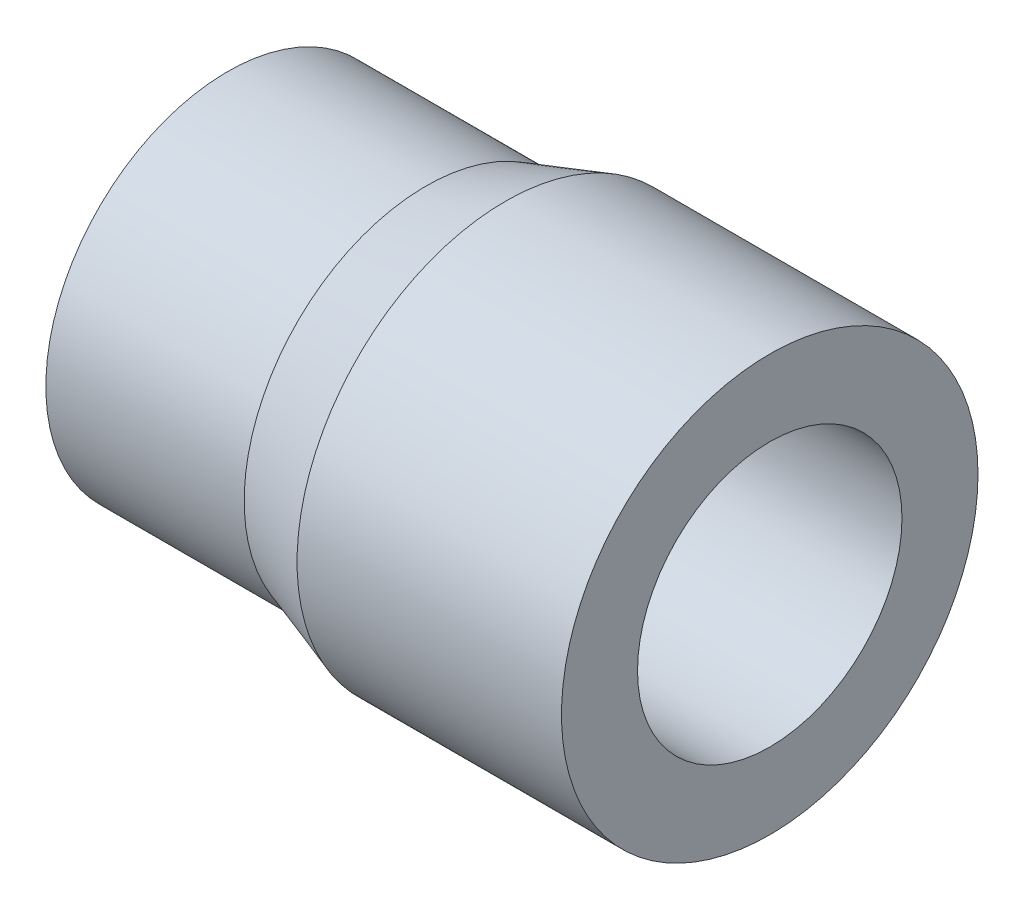
from build123d import *


with BuildPart() as part:
    # Croquis1 → Revolución1 (revolve)
    with BuildSketch(Plane(origin=(0, 0, 0), x_dir=(-1, 0, 0), z_dir=(0, 1, 0)), mode=Mode.PRIVATE) as revoluci_n1_sk:
        Polygon((0, 3.15), (0, 2), (8.2, 2), (8.2, 2.75), (5.2, 2.75), (4, 3.15), align=None)
    revolve(revoluci_n1_sk.sketch.rotate(Axis((0, 0, 0), (-1, 0, 0)), 180), axis=Axis((0, 0, 0), (-1, 0, 0)))


solid = part.part
